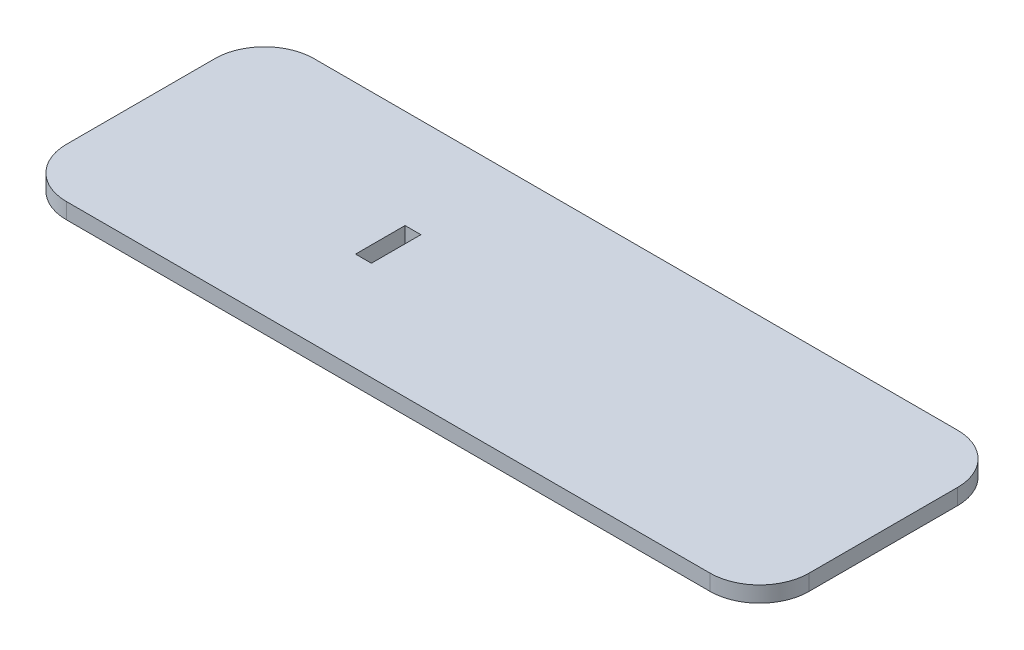
from build123d import *

# Parameters (mm, degrees)
BASE_SKETCH_W       = 150
BASE_SKETCH_H       = 50
BASE_SKETCH_W_2     = 3.2
BASE_SKETCH_H_2     = 10
BOSS_EXTRUDE1_DEPTH = 3.2
FILLET1_R           = 10


with BuildPart() as part:
    # Base_Sketch → Boss-Extrude1 (new body)
    with BuildSketch(Plane(origin=(0, 0, 0), x_dir=(1, 0, 0), z_dir=(0, 1, 0))):
        Rectangle(BASE_SKETCH_W, BASE_SKETCH_H)
        with Locations((-25, 0)):
            Rectangle(BASE_SKETCH_W_2, BASE_SKETCH_H_2, mode=Mode.SUBTRACT)
    extrude(amount=BOSS_EXTRUDE1_DEPTH)

    # Fillet1
    fillet1_edges = [part.edges().sort_by_distance(p)[0] for p in [
        (75, 1.6, 25),
        (-75, 1.6, 25),
        (-75, 1.6, -25),
        (75, 1.6, -25),
    ]]
    fillet(fillet1_edges, radius=FILLET1_R)


solid = part.part
